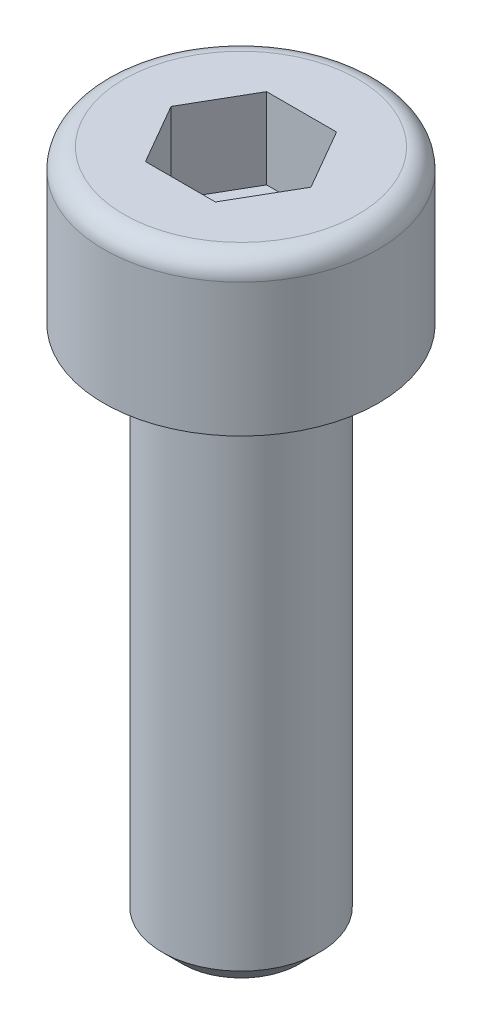
from build123d import *

# Parameters (mm, degrees)
ENL_V_MAT_EXTRU_1_DEPTH = 2


with BuildPart() as part:
    # Esquisse1 → Révolution1 (revolve)
    with BuildSketch(Plane.XY):
        with BuildLine():
            Line((0, 3.8), (-2.9, 3.8))
            ThreePointArc((-2.9, 3.8), (-3.253553391, 3.653553391), (-3.4, 3.3))
            Line((-3.4, 3.3), (-3.4, 0))
            Line((-3.4, 0), (-1.95, 0))
            Line((-1.95, 0), (-1.95, -12.5))
            Line((-1.95, -12.5), (-1.45, -13))
            Line((-1.45, -13), (0, -13))
            Line((0, -13), (0, 3.8))
        make_face()
    revolve(axis=Axis((0, 3.8, 0), (0, -1, 0)))

    # Esquisse2 → Enlèv. mat.-Extru.1 (cut)
    with BuildSketch(Plane(origin=(0, 3.8, 0), x_dir=(-1, 0, 0), z_dir=(0, 1, 0))):
        Polygon((-1.732050808, 0), (-0.866025404, -1.5), (0.866025404, -1.5), (1.732050808, 0), (0.866025404, 1.5), (-0.866025404, 1.5), align=None)
    extrude(amount=-ENL_V_MAT_EXTRU_1_DEPTH, mode=Mode.SUBTRACT)


solid = part.part
